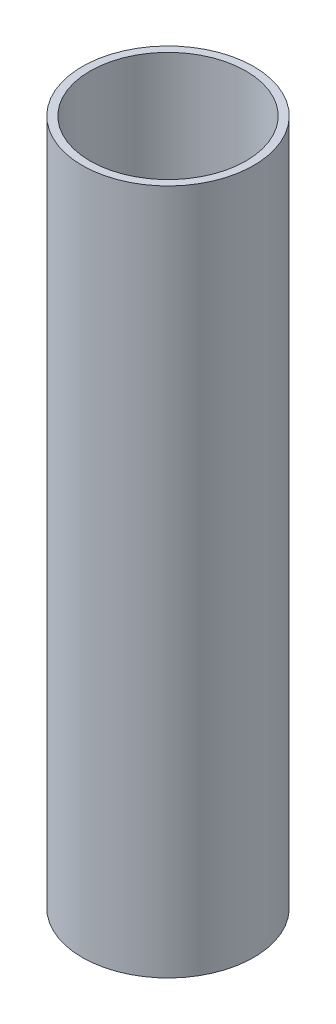
from build123d import *

# Parameters (mm, degrees)
SKETCH1_R           = 11
SKETCH1_R_2         = 10
BOSS_EXTRUDE1_DEPTH = 88


with BuildPart() as part:
    # Sketch1 → Boss-Extrude1 (new body)
    with BuildSketch(Plane(origin=(0, 0, 0), x_dir=(1, 0, 0), z_dir=(0, 1, 0))):
        with Locations(Location((0, 0, 0), (0, 0, 270))):
            Circle(SKETCH1_R)
        with Locations(Location((0, 0, 0), (0, 0, 270))):
            Circle(SKETCH1_R_2, mode=Mode.SUBTRACT)
    extrude(amount=BOSS_EXTRUDE1_DEPTH)


solid = part.part
